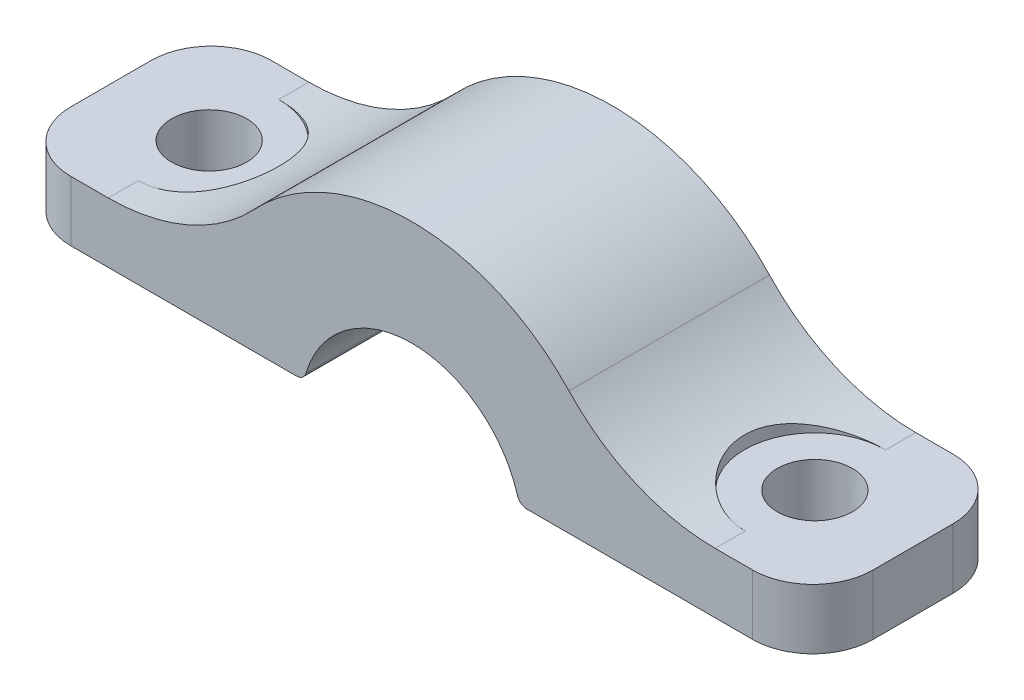
from build123d import *

# Parameters (mm, degrees)
BOSS_EXTRUDE1_START      = -1
SKETCH1_W                = 40
SKETCH1_H                = 10
BOSS_EXTRUDE1_DEPTH      = 5
BOSS_EXTRUDE2_DEPTH      = 5
BOSS_EXTRUDE2_DEPTH_BACK = 5
SKETCH3_W                = 12
SKETCH3_H                = 10
BOSS_EXTRUDE3_DEPTH      = 7
FILLET1_R                = 3
FILLET2_R                = 3
FILLET4_R                = 10
CUT_EXTRUDE1_DEPTH       = 25.669870287
CUT_EXTRUDE1_DEPTH_BACK  = 25.669870287
SKETCH4_R                = 1.875
CUT_EXTRUDE2_START       = 7
SKETCH5_R                = 3.5
CUT_EXTRUDE2_DEPTH       = 10
SKETCH9_W                = 47.094451366
SKETCH9_H                = 23.336565295
CUT_EXTRUDE5_DEPTH       = 4
FILLET5_R                = 0.5
SKETCH7_W                = 51.703075982
SKETCH7_H                = 23.04476915
CUT_EXTRUDE4_DEPTH       = 25.669870308


with BuildPart() as part:
    # Sketch1 → Boss-Extrude1 (new body)
    with BuildSketch(Plane(origin=(0, 0, 0), x_dir=(1, 0, 0), z_dir=(0, 1, 0)).offset(BOSS_EXTRUDE1_START)):
        Rectangle(SKETCH1_W, SKETCH1_H)
    extrude(amount=-BOSS_EXTRUDE1_DEPTH)

    # Fillet2
    fillet2_edges = [part.edges().sort_by_distance(p)[0] for p in [
        (-20, -3.5, 5),
        (-20, -3.5, -5),
        (20, -3.5, 5),
        (20, -3.5, -5),
    ]]
    fillet(fillet2_edges, radius=FILLET2_R)


with BuildPart() as body_2:
    # Sketch2 → Boss-Extrude2 (new, two sides: drawn at the far end of the back side and taken through both)
    with BuildSketch(Plane.XY.offset(-BOSS_EXTRUDE2_DEPTH_BACK)):
        with BuildLine():
            Line((-10.378945033, 0), (-4.733920151, 0))
            ThreePointArc((-4.733920151, 0), (0, 8.3), (4.733920151, 0))
            Line((4.733920151, 0), (10.378945033, 0))
            ThreePointArc((10.378945033, 0), (0, 13.55), (-10.378945033, 0))
        make_face()
    extrude(amount=BOSS_EXTRUDE2_DEPTH + BOSS_EXTRUDE2_DEPTH_BACK)

    # Sketch3 → Boss-Extrude3 (add)
    with BuildSketch(Plane(origin=(0, 0, 0), x_dir=(1, 0, 0), z_dir=(0, 1, 0))):
        with Locations((-14, 0)):
            Rectangle(SKETCH3_W, SKETCH3_H)
        with Locations((14, 0)):
            Rectangle(SKETCH3_W, SKETCH3_H)
    extrude(amount=BOSS_EXTRUDE3_DEPTH)

    # Fillet1
    fillet1_edges = [body_2.edges().sort_by_distance(p)[0] for p in [
        (20, 3.5, -5),
        (20, 3.5, 5),
        (-20, 3.5, -5),
        (-20, 3.5, 5),
    ]]
    fillet(fillet1_edges, radius=FILLET1_R)

    # Fillet4
    fillet4_edges = [body_2.edges().sort_by_distance(p)[0] for p in [
        (9.895579821, 7, 0),
        (-9.895579821, 7, 0),
    ]]
    fillet(fillet4_edges, radius=FILLET4_R)


with BuildPart() as cut_extrude1_tool:
    # Sketch4 → Cut-Extrude1 (new, two sides: drawn at the far end of the back side and taken through both)
    with BuildSketch(Plane(origin=(0, 0, 0), x_dir=(1, 0, 0), z_dir=(0, 1, 0)).offset(-CUT_EXTRUDE1_DEPTH_BACK)):
        with Locations((-15.1, 0)):
            Circle(SKETCH4_R)
        with Locations((15.1, 0)):
            Circle(SKETCH4_R)
    extrude(amount=CUT_EXTRUDE1_DEPTH + CUT_EXTRUDE1_DEPTH_BACK)


with BuildPart() as part_1:
    add(part.part)

    # Cut-Extrude1: cut by cut_extrude1_tool
    add(cut_extrude1_tool.part, mode=Mode.SUBTRACT)

    # Sketch7 → Cut-Extrude4 (cut, through all)
    with BuildSketch(Plane(origin=(0, 0, 0), x_dir=(1, 0, 0), z_dir=(0, 1, 0))):
        with Locations((-1.693322056, -1.721439234)):
            Rectangle(SKETCH7_W, SKETCH7_H)
    extrude(amount=-CUT_EXTRUDE4_DEPTH, mode=Mode.SUBTRACT)


with BuildPart() as body_2_1:
    add(body_2.part)

    # Cut-Extrude1: cut by cut_extrude1_tool
    add(cut_extrude1_tool.part, mode=Mode.SUBTRACT)

    # Sketch5 → Cut-Extrude2 (cut)
    with BuildSketch(Plane(origin=(0, 0, 0), x_dir=(1, 0, 0), z_dir=(0, 1, 0)).offset(CUT_EXTRUDE2_START)):
        with Locations((-15.1, 0)):
            Circle(SKETCH5_R)
        with Locations((15.1, 0)):
            Circle(SKETCH5_R)
    extrude(amount=CUT_EXTRUDE2_DEPTH, mode=Mode.SUBTRACT)

    # Sketch9 → Cut-Extrude5 (cut)
    with BuildSketch(Plane(origin=(0, 0, 0), x_dir=(1, 0, 0), z_dir=(0, 1, 0))):
        with Locations((2.081495267, 0.004136026)):
            Rectangle(SKETCH9_W, SKETCH9_H)
    extrude(amount=CUT_EXTRUDE5_DEPTH, mode=Mode.SUBTRACT)

    # Fillet5
    fillet5_edges = [body_2_1.edges().sort_by_distance(p)[0] for p in [
        (-5.36749476, 4, 0),
        (5.36749476, 4, 0),
    ]]
    fillet(fillet5_edges, radius=FILLET5_R)


solid = body_2_1.part
